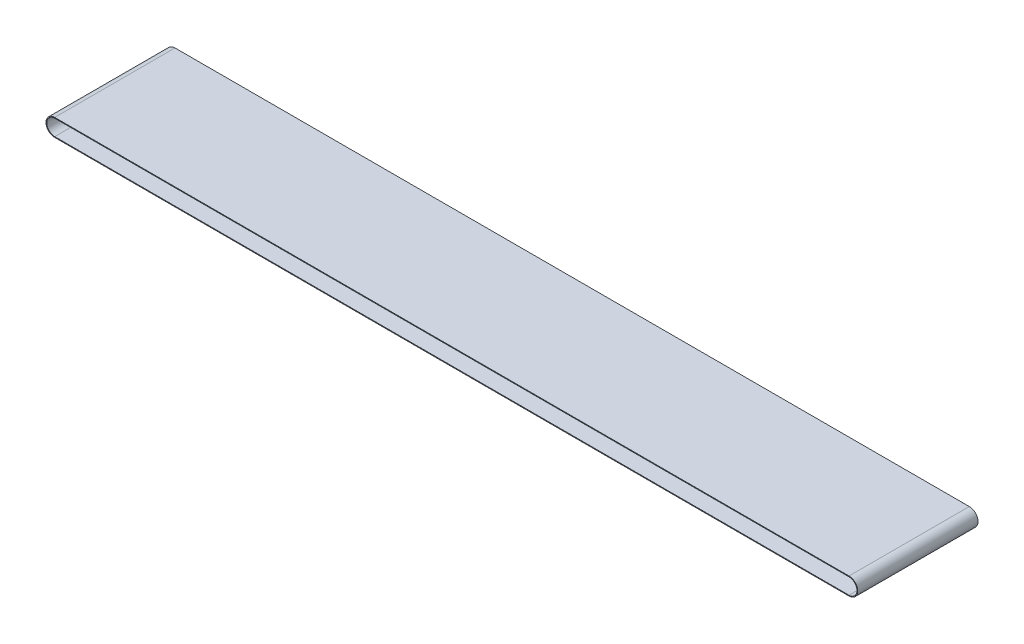
from build123d import *

# Parameters (mm, degrees)
BOSS_EXTRUDE1_DEPTH = 79.5


with BuildPart() as part:
    # Sketch1 → Boss-Extrude1 (new, symmetric)
    with BuildSketch(Plane.XY):
        with BuildLine():
            Line((-525, 11.5), (525, 11.5))
            ThreePointArc((525, 11.5), (536.5, 0), (525, -11.5))
            Line((525, -11.5), (-525, -11.5))
            ThreePointArc((-525, -11.5), (-536.5, 0), (-525, 11.5))
        make_face()
        with BuildLine():
            Line((-525, 10.5), (525, 10.5))
            ThreePointArc((525, 10.5), (535.5, 0), (525, -10.5))
            Line((525, -10.5), (-525, -10.5))
            ThreePointArc((-525, -10.5), (-535.5, 0), (-525, 10.5))
        make_face(mode=Mode.SUBTRACT)
    extrude(amount=BOSS_EXTRUDE1_DEPTH, both=True)


solid = part.part
